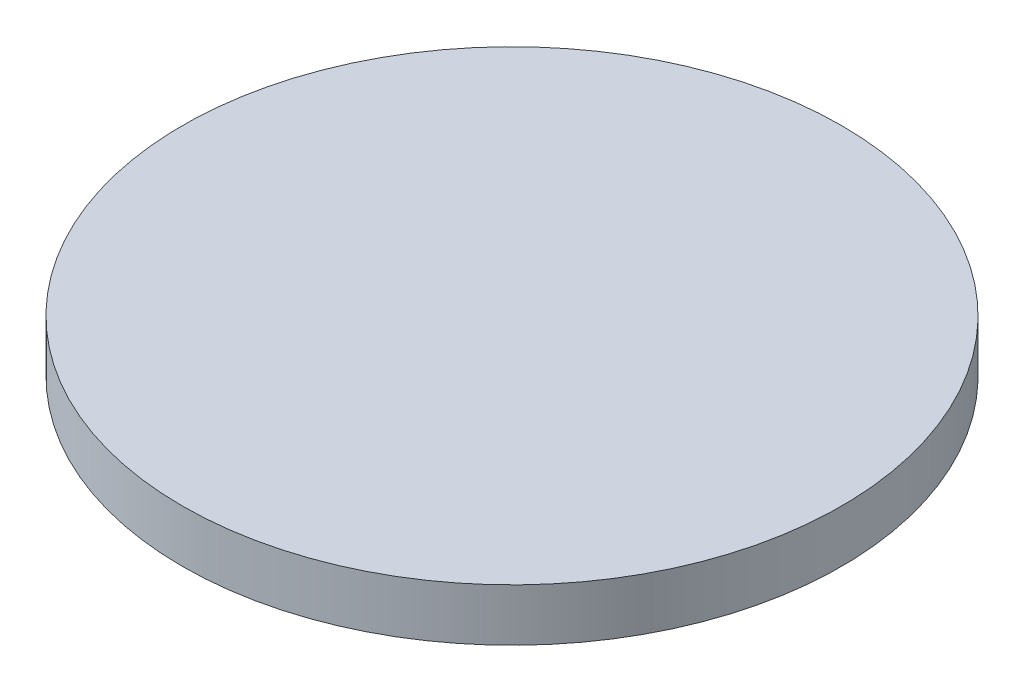
from build123d import *

# Parameters (mm, degrees)
ESQUISSE1_R        = 40
BOSS_EXTRU_1_DEPTH = 6.35


with BuildPart() as part:
    # Esquisse1 → Boss.-Extru.1 (new body)
    with BuildSketch(Plane(origin=(0, 0, 0), x_dir=(1, 0, 0), z_dir=(0, 1, 0))):
        with Locations(Location((0, 0, 0), (0, 0, 270))):
            Circle(ESQUISSE1_R)
    extrude(amount=BOSS_EXTRU_1_DEPTH)


solid = part.part
